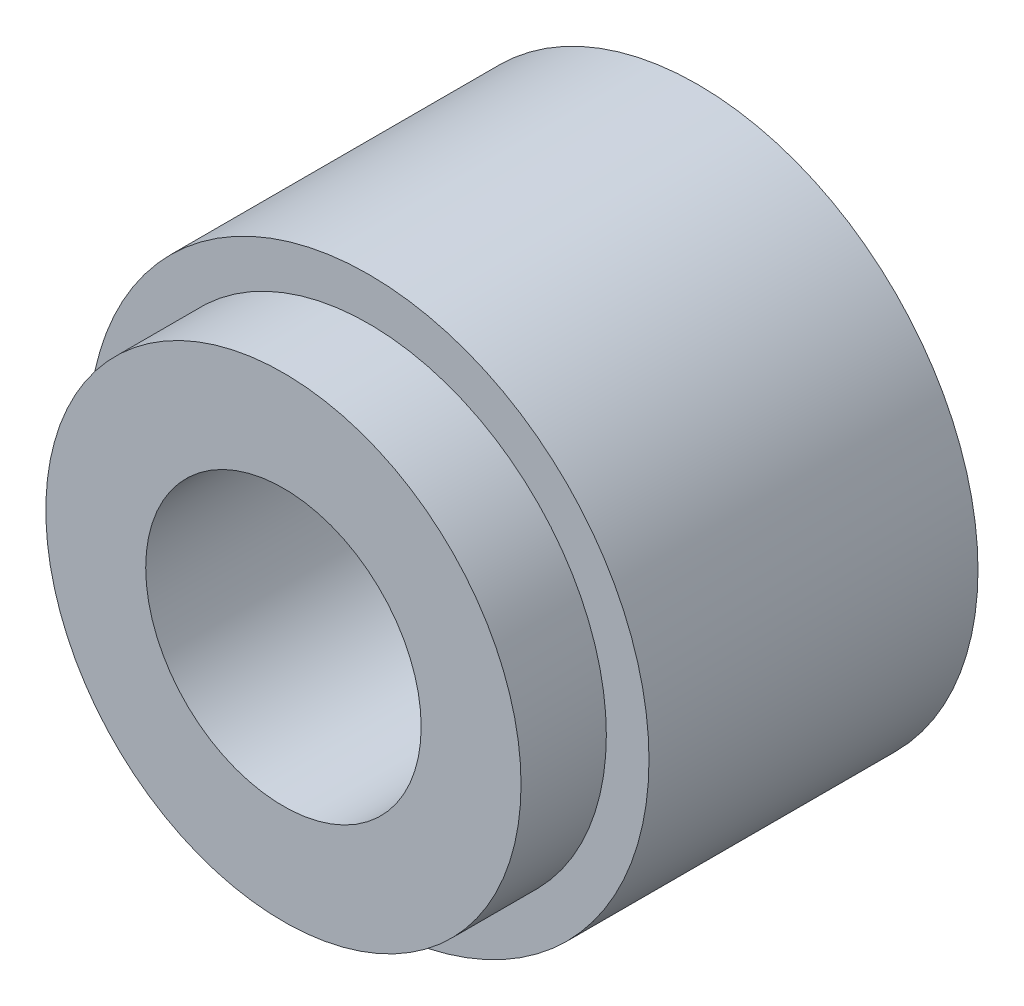
from build123d import *

# Parameters (mm, degrees)
ESQUISSE1_R      = 2.3
EXTRUSION1_DEPTH = 2.7
ESQUISSE2_R      = 1.95
EXTRUSION2_DEPTH = 0.7


with BuildPart() as part:
    # Esquisse1 → Extrusion1 (new body)
    with BuildSketch(Plane.XY):
        with Locations(Location((0, 0, 0), (0, 0, 180))):
            Circle(ESQUISSE1_R)
    extrude(amount=EXTRUSION1_DEPTH)

    # Esquisse2 → Extrusion2 (add)
    with BuildSketch(Plane.XY.offset(2.7)):
        Circle(ESQUISSE2_R)
    extrude(amount=EXTRUSION2_DEPTH)

    # Esquisse4 → #4-40 Tapped Hole1 (revolve, cut)
    with BuildSketch(Plane(origin=(0, 0, 3.4), x_dir=(0, -1, 0), z_dir=(1, 0, 0))):
        Polygon((0, 0), (0, 3.4), (1.27, 3.4), (1.1303, 3.2603), (1.1303, 0), align=None)
    revolve(axis=Axis((0, 0, 9.75), (0, 0, -1)), mode=Mode.SUBTRACT)


solid = part.part
